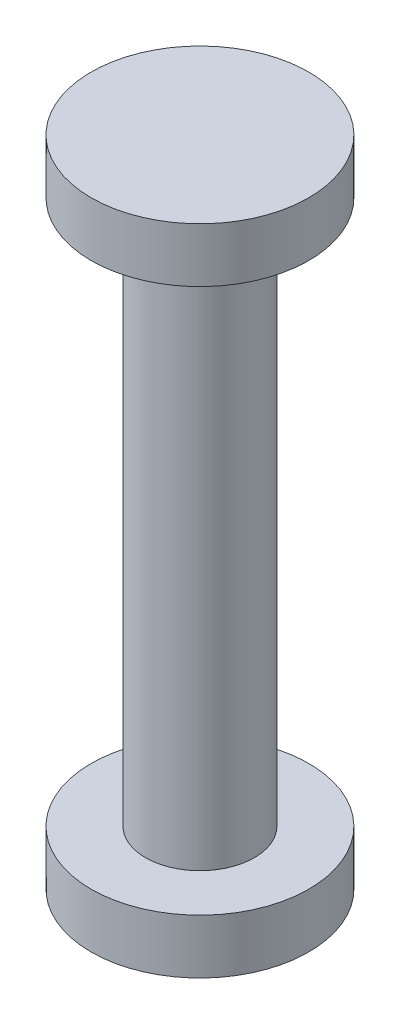
from build123d import *

# Parameters (mm, degrees)
SKETCH1_R           = 5
BOSS_EXTRUDE1_DEPTH = 25
SKETCH2_R           = 10
BOSS_EXTRUDE2_DEPTH = 5


with BuildPart() as part:
    # Sketch1 → Boss-Extrude1 (new, symmetric)
    with BuildSketch(Plane(origin=(0, 0, 0), x_dir=(1, 0, 0), z_dir=(0, 1, 0))):
        with Locations(Location((0, 0, 0), (0, 0, 270))):
            Circle(SKETCH1_R)
    extrude(amount=BOSS_EXTRUDE1_DEPTH, both=True)

    # Sketch2 → Boss-Extrude2 (add)
    with BuildSketch(Plane(origin=(0, 25, 0), x_dir=(1, 0, 0), z_dir=(0, 1, 0))):
        with Locations(Location((0, 0, 0), (0, 0, 270))):
            Circle(SKETCH2_R)
    boss_extrude2 = extrude(amount=BOSS_EXTRUDE2_DEPTH)

    # Mirror2: Boss-Extrude2 across plane
    add(boss_extrude2.mirror(Plane.ZX))


solid = part.part
